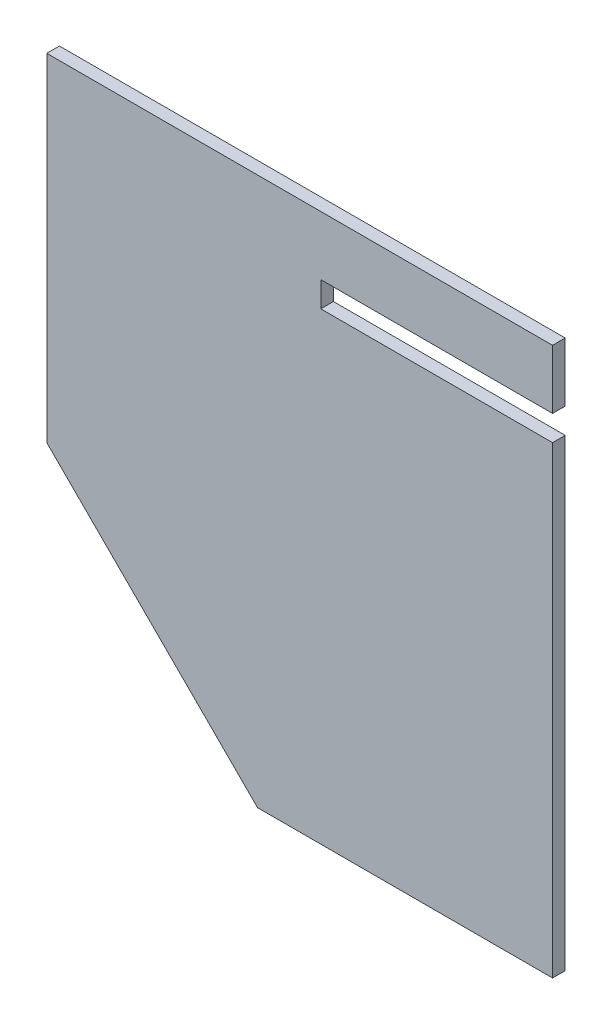
from build123d import *

# Parameters (mm, degrees)
AUFSATZ_LINEAR_AUSTRAGEN1_DEPTH = 3


with BuildPart() as part:
    # Skizze1 → Aufsatz-Linear austragen1 (new body)
    with BuildSketch(Plane.XY):
        Polygon((0, 0), (70, 0), (70, 110), (15, 110), (15, 116), (70, 116), (70, 130), (-50, 130), (-50, 50), align=None)
    extrude(amount=AUFSATZ_LINEAR_AUSTRAGEN1_DEPTH)


solid = part.part
